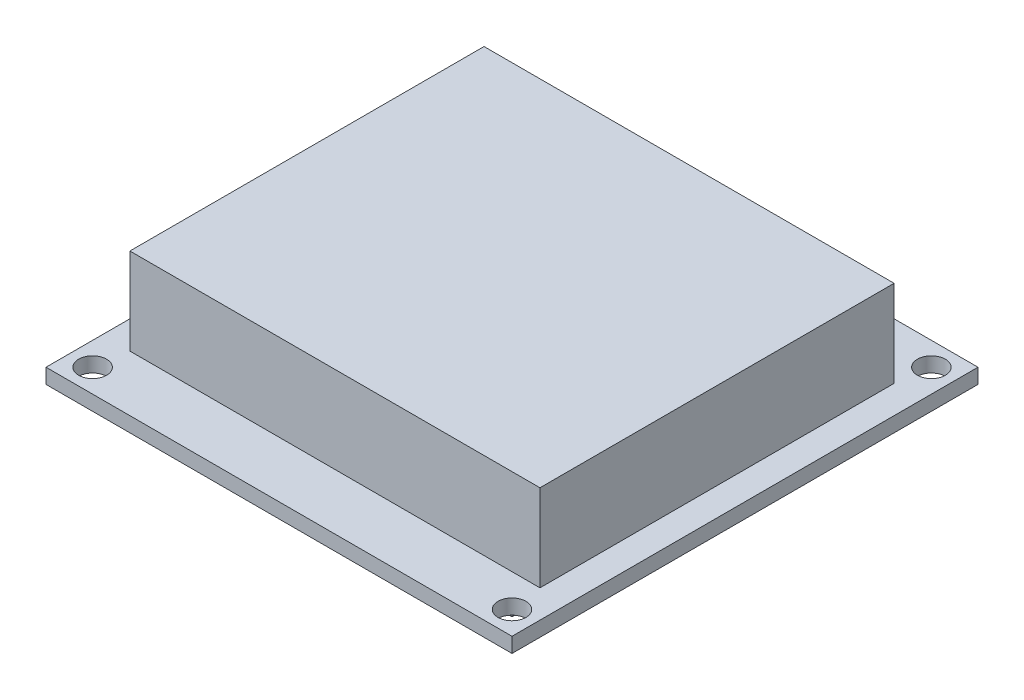
from build123d import *

# Parameters (mm, degrees)
SK_BOARD_W              = 50
SK_BOARD_H              = 50
EX_BOARD_DEPTH          = 1.6
SK_MOUNTHOLES_4X_R      = 1.5
CUT_MOUNTHOLES_4X_DEPTH = 1.6
SK_COMPONENTS_W         = 44
SK_COMPONENTS_H         = 38
EX_COMPONENTS_DEPTH     = 9.3
SK_PINS_W               = 40
SK_PINS_H               = 40
EX_PINS_DEPTH           = 1.6


with BuildPart() as part:
    # SK_Board → EX_Board (new body)
    with BuildSketch(Plane(origin=(0, 0, 0), x_dir=(1, 0, 0), z_dir=(0, 1, 0))):
        Rectangle(SK_BOARD_W, SK_BOARD_H)
    extrude(amount=EX_BOARD_DEPTH)

    # SK_MountHoles_4x → CUT_MountHoles_4x (cut)
    with BuildSketch(Plane(origin=(0, 0, 0), x_dir=(1, 0, 0), z_dir=(0, 1, 0))):
        with Locations((22.5, -22.5)):
            Circle(SK_MOUNTHOLES_4X_R)
        with Locations((-22.5, -22.5)):
            Circle(SK_MOUNTHOLES_4X_R)
        with Locations((22.5, 22.5)):
            Circle(SK_MOUNTHOLES_4X_R)
        with Locations((-22.5, 22.5)):
            Circle(SK_MOUNTHOLES_4X_R)
    extrude(amount=CUT_MOUNTHOLES_4X_DEPTH, mode=Mode.SUBTRACT)

    # SK_Components → EX_Components (add)
    with BuildSketch(Plane(origin=(0, 1.6, 0), x_dir=(1, 0, 0), z_dir=(0, 1, 0))):
        Rectangle(SK_COMPONENTS_W, SK_COMPONENTS_H)
    extrude(amount=EX_COMPONENTS_DEPTH)

    # SK_Pins → EX_Pins (add)
    with BuildSketch(Plane(origin=(0, 0, 0), x_dir=(1, 0, 0), z_dir=(0, 1, 0))):
        Rectangle(SK_PINS_W, SK_PINS_H)
    extrude(amount=-EX_PINS_DEPTH)


solid = part.part
